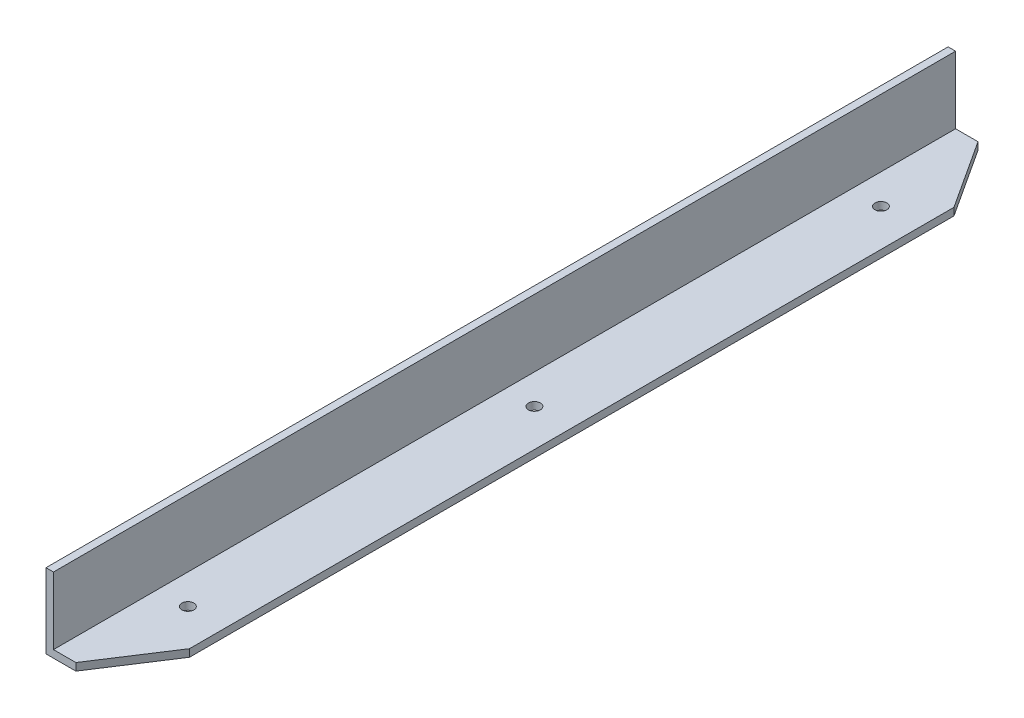
from build123d import *

# Parameters (mm, degrees)
BOSS_EXTRUDE1_DEPTH = 302.01
SKETCH2_R           = 4
CUT_EXTRUDE1_DEPTH  = 20
CUT_EXTRUDE2_DEPTH  = 8
LPATTERN1_COUNT     = 3
LPATTERN1_PITCH     = 232.01


with BuildPart() as part:
    # Sketch1 → Boss-Extrude1 (new, symmetric)
    with BuildSketch(Plane.XY):
        Polygon((-16.725146199, 34.538011696), (-11.725146199, 34.538011696), (-11.725146199, -10.461988304), (33.274853801, -10.461988304), (33.274853801, -15.461988304), (-16.725146199, -15.461988304), align=None)
    extrude(amount=BOSS_EXTRUDE1_DEPTH, both=True)

    # Sketch2 → Cut-Extrude1 (cut)
    with BuildSketch(Plane(origin=(0, -10.461988304, 0), x_dir=(1, 0, 0), z_dir=(0, 1, 0))):
        with Locations(Location((8.274853801, 232.01, 0), (0, 0, 270))):
            Circle(SKETCH2_R)
    cut_extrude1 = extrude(amount=-CUT_EXTRUDE1_DEPTH, mode=Mode.SUBTRACT)

    # Sketch3 → Cut-Extrude2 (cut)
    with BuildSketch(Plane(origin=(0, -10.461988304, 0), x_dir=(1, 0, 0), z_dir=(0, 1, 0))):
        Polygon((33.274853801, 255.912277714), (3.274853801, 302.01), (33.274853801, 302.01), align=None)
    cut_extrude2 = extrude(amount=-CUT_EXTRUDE2_DEPTH, mode=Mode.SUBTRACT)

    # Mirror2: Cut-Extrude2 across plane
    add(cut_extrude2.mirror(Plane.XY), mode=Mode.SUBTRACT)

    # LPattern1: Cut-Extrude1 ×3
    with Locations(*[(0, 0, i * LPATTERN1_PITCH) for i in range(1, LPATTERN1_COUNT)]):
        add(cut_extrude1, mode=Mode.SUBTRACT)


solid = part.part
